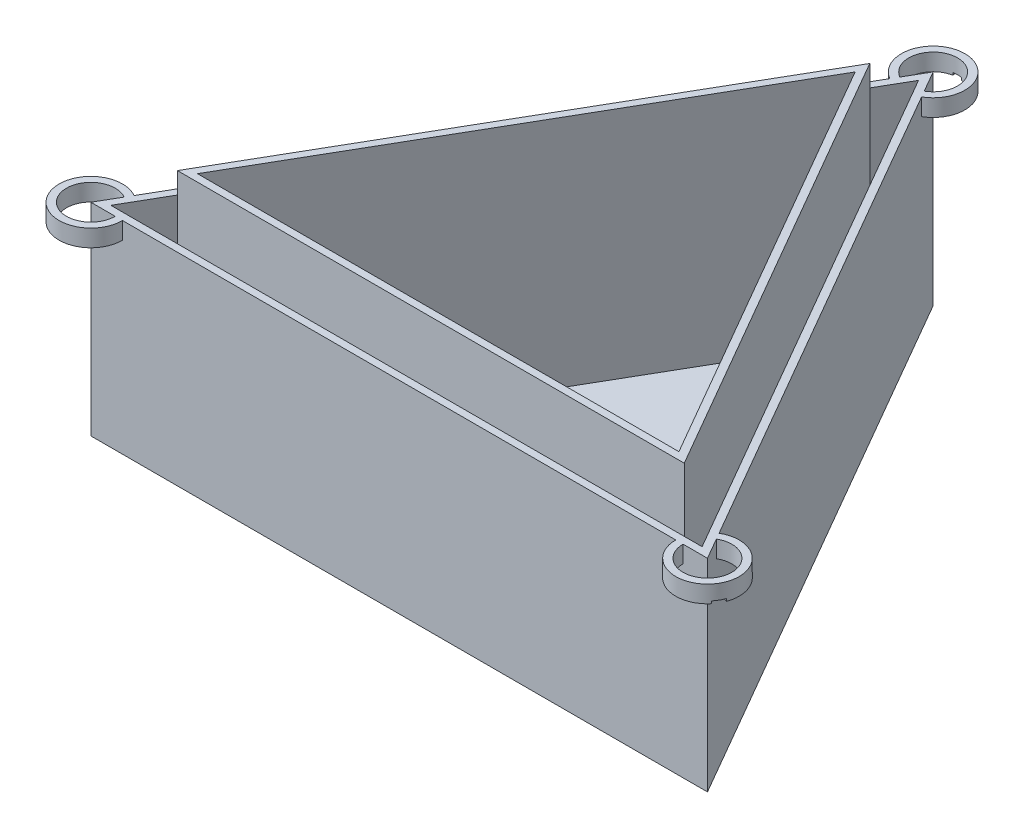
from build123d import *

# Parameters (mm, degrees)
BOSS_EXTRUDE1_DEPTH          = 3.5
CUT_EXTRUDE1_DEPTH           = 0.5
CUT_EXTRUDE2_DEPTH           = 0.5
CUT_EXTRUDE3_DEPTH           = 0.5
BOSS_EXTRUDE2_DEPTH          = 38
CUT_EXTRUDE4_DEPTH           = 40
BOSS_EXTRUDE3_DEPTH          = 48
CUT_EXTRUDE5_DEPTH           = 48
F_2_45_2_45_DIAMETER_HOLE1_D = 2.45


with BuildPart() as part:
    # Sketch1 → Boss-Extrude1 (new body)
    with BuildSketch(Plane.XZ.offset(-38)):
        with BuildLine():
            Line((3.25, -67.370834875), (59.969854476, 30.870834875))
            ThreePointArc((59.969854476, 30.870834875), (68.849019601, 39.75), (56.719854476, 36.5))
            Line((56.719854476, 36.5), (-56.719854476, 36.5))
            ThreePointArc((-56.719854476, 36.5), (-68.849019601, 39.75), (-59.969854476, 30.870834875))
            Line((-59.969854476, 30.870834875), (-3.25, -67.370834875))
            ThreePointArc((-3.25, -67.370834875), (0, -79.5), (3.25, -67.370834875))
        make_face()
        with BuildLine():
            Line((-2.5, -68.669872981), (0, -73))
            Line((0, -73), (2.5, -68.669872981))
            ThreePointArc((2.5, -68.669872981), (0, -78), (-2.5, -68.669872981))
        make_face(mode=Mode.SUBTRACT)
        with BuildLine():
            Line((-58.219854476, 36.5), (-63.219854476, 36.5))
            Line((-63.219854476, 36.5), (-60.719854476, 32.169872981))
            ThreePointArc((-60.719854476, 32.169872981), (-67.549981495, 39), (-58.219854476, 36.5))
        make_face(mode=Mode.SUBTRACT)
        with BuildLine():
            Line((60.719854476, 32.169872981), (63.219854476, 36.5))
            Line((63.219854476, 36.5), (58.219854476, 36.5))
            ThreePointArc((58.219854476, 36.5), (67.549981495, 39), (60.719854476, 32.169872981))
        make_face(mode=Mode.SUBTRACT)
    extrude(amount=-BOSS_EXTRUDE1_DEPTH)

    # Sketch2 → Cut-Extrude1 (cut)
    with BuildSketch(Plane.XZ.offset(-38)):
        with BuildLine():
            Line((1.128713155, -79.401250395), (0.868240888, -77.924038765))
            ThreePointArc((0.868240888, -77.924038765), (0, -78), (-0.868240888, -77.924038765))
            Line((-0.868240888, -77.924038765), (-1.128713155, -79.401250395))
            ThreePointArc((-1.128713155, -79.401250395), (0, -79.5), (1.128713155, -79.401250395))
        make_face()
    extrude(amount=-CUT_EXTRUDE1_DEPTH, mode=Mode.SUBTRACT)

    # Sketch3 → Cut-Extrude2 (cut)
    with BuildSketch(Plane.XZ.offset(-38)):
        with BuildLine():
            Line((-69.327856511, 38.723130932), (-67.91831758, 38.210100717))
            ThreePointArc((-67.91831758, 38.210100717), (-67.549981495, 39), (-67.050076692, 39.713938048))
            Line((-67.050076692, 39.713938048), (-68.199143357, 40.678119463))
            ThreePointArc((-68.199143357, 40.678119463), (-68.849019601, 39.75), (-69.327856511, 38.723130932))
        make_face()
    extrude(amount=-CUT_EXTRUDE2_DEPTH, mode=Mode.SUBTRACT)

    # Sketch4 → Cut-Extrude3 (cut)
    with BuildSketch(Plane.XZ.offset(-38)):
        with BuildLine():
            Line((67.91831758, 38.210100717), (69.327856511, 38.723130932))
            ThreePointArc((69.327856511, 38.723130932), (68.849019601, 39.75), (68.199143357, 40.678119463))
            Line((68.199143357, 40.678119463), (67.050076692, 39.713938048))
            ThreePointArc((67.050076692, 39.713938048), (67.549981495, 39), (67.91831758, 38.210100717))
        make_face()
    extrude(amount=-CUT_EXTRUDE3_DEPTH, mode=Mode.SUBTRACT)

    # Sketch5 → Boss-Extrude2 (add)
    with BuildSketch(Plane.XZ.offset(-38)):
        Polygon((0, -73), (-63.219854476, 36.5), (63.219854476, 36.5), align=None)
    extrude(amount=BOSS_EXTRUDE2_DEPTH)

    # Sketch6 → Cut-Extrude4 (cut)
    with BuildSketch(Plane(origin=(0, 41.5, 0), x_dir=(-1, 0, 0), z_dir=(0, 1, 0))):
        Polygon((0, -70), (60.621778265, 35), (-60.621778265, 35), align=None)
    extrude(amount=-CUT_EXTRUDE4_DEPTH, mode=Mode.SUBTRACT)

    # Sketch7 → Boss-Extrude3 (add)
    with BuildSketch(Plane(origin=(0, 1.5, 0), x_dir=(-1, 0, 0), z_dir=(0, 1, 0))):
        Polygon((0, -60), (-51.961524227, 30), (51.961524227, 30), align=None)
    extrude(amount=BOSS_EXTRUDE3_DEPTH)

    # Sketch8 → Cut-Extrude5 (cut)
    with BuildSketch(Plane(origin=(0, 49.5, 0), x_dir=(-1, 0, 0), z_dir=(0, 1, 0))):
        Polygon((49.363448016, 28.5), (-49.363448016, 28.5), (0, -57), align=None)
    extrude(amount=-CUT_EXTRUDE5_DEPTH, mode=Mode.SUBTRACT)

    # Ø2.45 (2.45) Diameter Hole1 (through all)
    with Locations(Plane(origin=(0, 1.5, 0), x_dir=(1, 0, 0), z_dir=(0, 1, 0))):
        with Locations((-13.95, 13.95), (13.95, -13.95), (-13.95, -13.95), (13.95, 13.95)):
            Hole(F_2_45_2_45_DIAMETER_HOLE1_D / 2)


solid = part.part
